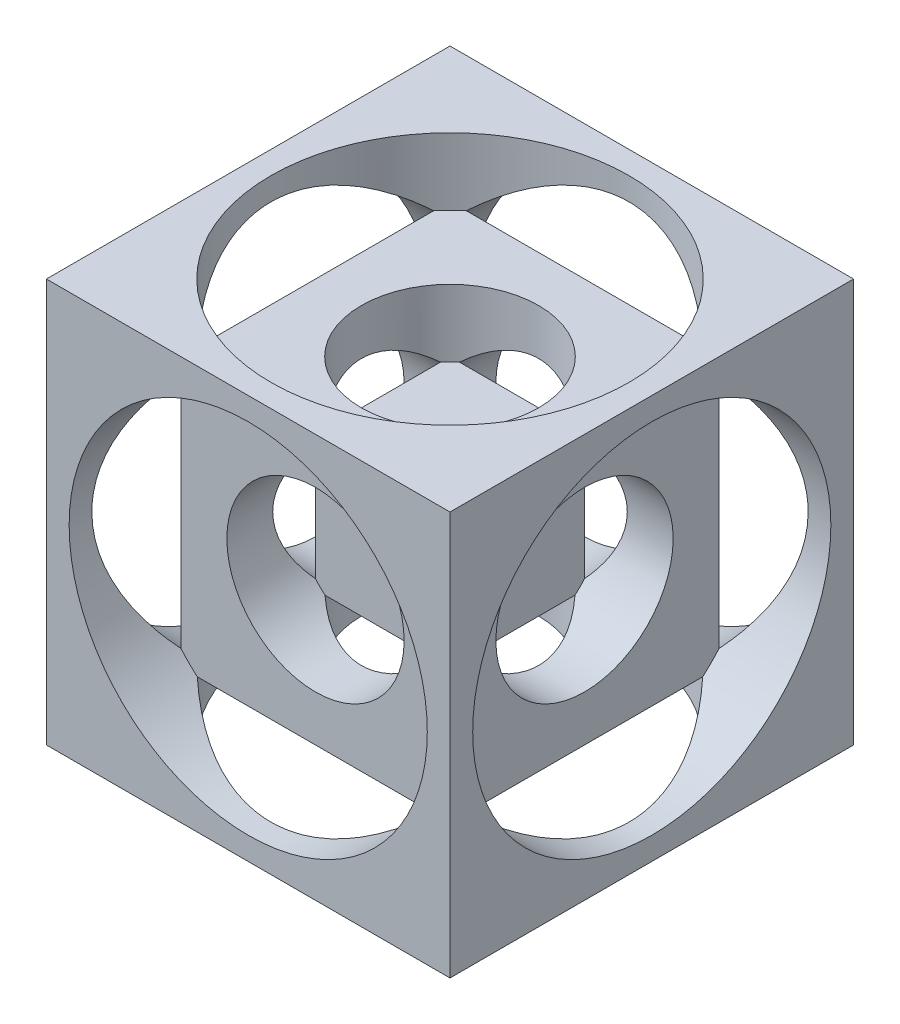
from build123d import *

# Parameters (mm, degrees)
BOSS_EXTRUDE1_DEPTH         = 22.86
BOSS_EXTRUDE1_DEPTH_BACK    = 22.86
SKETCH1_W                   = 45.72
SKETCH1_H                   = 45.72
SKETCH4_R                   = 20.287199642
CUT_EXTRUDE1_DEPTH          = 7.62
SKETCH5_R                   = 10.041617815
CUT_EXTRUDE2_DEPTH          = 15.24
CIRPATTERN1_COUNT           = 4
CIRPATTERN2_COPY_1_SKETCH_R = 20.287199642
CIRPATTERN2_COPY_1_DEPTH    = 7.62
CIRPATTERN2_COPY_2_SKETCH_R = 20.287199642
CIRPATTERN2_COPY_2_DEPTH    = 7.62
CIRPATTERN2_COPY_3_SKETCH_R = 20.287199642
CIRPATTERN2_COPY_3_DEPTH    = 7.62
CIRPATTERN2_COPY_4_SKETCH_R = 10.041617815
CIRPATTERN2_COPY_4_DEPTH    = 15.24
CIRPATTERN2_COPY_5_SKETCH_R = 10.041617815
CIRPATTERN2_COPY_5_DEPTH    = 15.24
CIRPATTERN2_COPY_6_SKETCH_R = 10.041617815
CIRPATTERN2_COPY_6_DEPTH    = 15.24
CIRPATTERN2_COPY_7_SKETCH_R = 20.287199642
CIRPATTERN2_COPY_7_DEPTH    = 7.62
CIRPATTERN2_COPY_8_SKETCH_R = 10.041617815
CIRPATTERN2_COPY_8_DEPTH    = 15.24


with BuildPart() as part:
    # Sketch1 → Boss-Extrude1 (new, two sides: drawn at the far end of the back side and taken through both)
    with BuildSketch(Plane.XY.offset(-BOSS_EXTRUDE1_DEPTH_BACK)):
        Rectangle(SKETCH1_W, SKETCH1_H)
    extrude(amount=BOSS_EXTRUDE1_DEPTH + BOSS_EXTRUDE1_DEPTH_BACK)

    # Sketch4 → Cut-Extrude1 (cut)
    with BuildSketch(Plane.XY.offset(22.86)):
        Circle(SKETCH4_R)
    cut_extrude1 = extrude(amount=-CUT_EXTRUDE1_DEPTH, mode=Mode.SUBTRACT)

    # Sketch5 → Cut-Extrude2 (cut)
    with BuildSketch(Plane.XY.offset(22.86)):
        Circle(SKETCH5_R)
    cut_extrude2 = extrude(amount=-CUT_EXTRUDE2_DEPTH, mode=Mode.SUBTRACT)

    # CirPattern1: Cut-Extrude1, Cut-Extrude2 ×4 about axis
    cirpattern1_axis = Axis((0, 25.146, 0), (0, -1, 0))
    add([cut_extrude1.rotate(cirpattern1_axis, i * 360 / CIRPATTERN1_COUNT) for i in range(1, CIRPATTERN1_COUNT)], mode=Mode.SUBTRACT)
    add([cut_extrude2.rotate(cirpattern1_axis, i * 360 / CIRPATTERN1_COUNT) for i in range(1, CIRPATTERN1_COUNT)], mode=Mode.SUBTRACT)

    # CirPattern2 copy 1 sketch → CirPattern2 copy 1 (cut)
    with BuildSketch(Plane(origin=(-22.86, 0, 0), x_dir=(0, -1, 0), z_dir=(-1, 0, 0))):
        Circle(CIRPATTERN2_COPY_1_SKETCH_R)
    extrude(amount=-CIRPATTERN2_COPY_1_DEPTH, mode=Mode.SUBTRACT)

    # CirPattern2 copy 2 sketch → CirPattern2 copy 2 (cut)
    with BuildSketch(Plane(origin=(0, 22.86, 0), x_dir=(-1, 0, 0), z_dir=(0, 1, 0))):
        Circle(CIRPATTERN2_COPY_2_SKETCH_R)
    extrude(amount=-CIRPATTERN2_COPY_2_DEPTH, mode=Mode.SUBTRACT)

    # CirPattern2 copy 3 sketch → CirPattern2 copy 3 (cut)
    with BuildSketch(Plane.YZ.offset(22.86)):
        Circle(CIRPATTERN2_COPY_3_SKETCH_R)
    extrude(amount=-CIRPATTERN2_COPY_3_DEPTH, mode=Mode.SUBTRACT)

    # CirPattern2 copy 4 sketch → CirPattern2 copy 4 (cut)
    with BuildSketch(Plane(origin=(-22.86, 0, 0), x_dir=(0, -1, 0), z_dir=(-1, 0, 0))):
        Circle(CIRPATTERN2_COPY_4_SKETCH_R)
    extrude(amount=-CIRPATTERN2_COPY_4_DEPTH, mode=Mode.SUBTRACT)

    # CirPattern2 copy 5 sketch → CirPattern2 copy 5 (cut)
    with BuildSketch(Plane(origin=(0, 22.86, 0), x_dir=(-1, 0, 0), z_dir=(0, 1, 0))):
        Circle(CIRPATTERN2_COPY_5_SKETCH_R)
    extrude(amount=-CIRPATTERN2_COPY_5_DEPTH, mode=Mode.SUBTRACT)

    # CirPattern2 copy 6 sketch → CirPattern2 copy 6 (cut)
    with BuildSketch(Plane.YZ.offset(22.86)):
        Circle(CIRPATTERN2_COPY_6_SKETCH_R)
    extrude(amount=-CIRPATTERN2_COPY_6_DEPTH, mode=Mode.SUBTRACT)

    # CirPattern2 copy 7 sketch → CirPattern2 copy 7 (cut)
    with BuildSketch(Plane.XZ.offset(22.86)):
        Circle(CIRPATTERN2_COPY_7_SKETCH_R)
    extrude(amount=-CIRPATTERN2_COPY_7_DEPTH, mode=Mode.SUBTRACT)

    # CirPattern2 copy 8 sketch → CirPattern2 copy 8 (cut)
    with BuildSketch(Plane.XZ.offset(22.86)):
        Circle(CIRPATTERN2_COPY_8_SKETCH_R)
    extrude(amount=-CIRPATTERN2_COPY_8_DEPTH, mode=Mode.SUBTRACT)


solid = part.part
